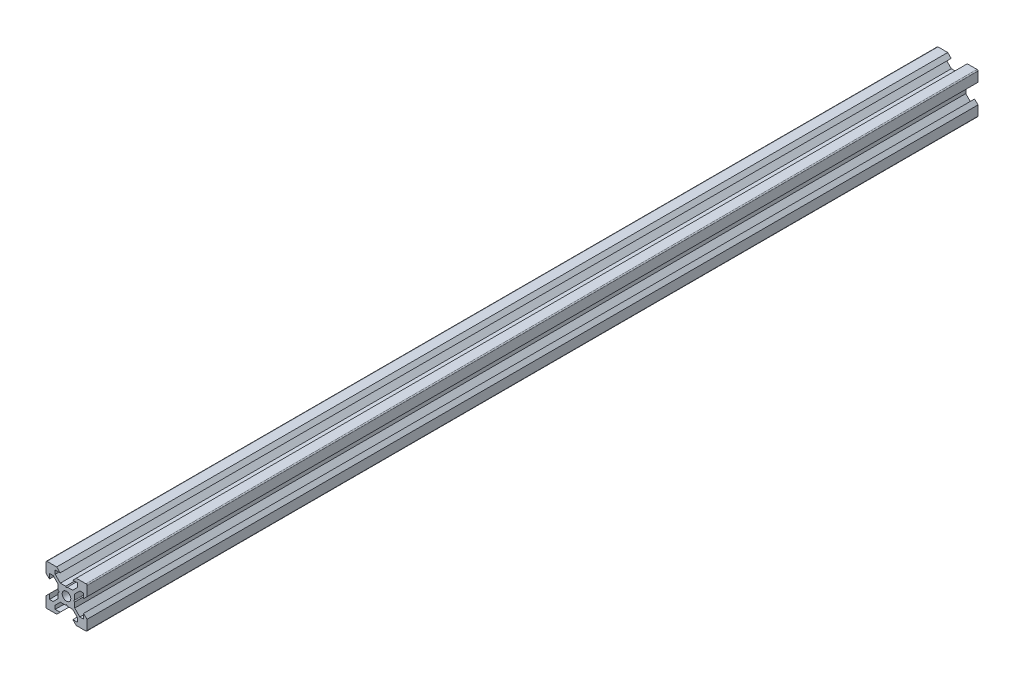
from build123d import *

# Parameters (mm, degrees)
SKETCH1_R           = 2.1
BOSS_EXTRUDE1_DEPTH = 435
FILLET1_R           = 0.5
CUT_EXTRUDE1_DEPTH  = 436.229824346


with BuildPart() as part:
    # Sketch1 → Boss-Extrude1 (new body)
    with BuildSketch(Plane.XY):
        Polygon((-10, 10), (-4.775, 10), (-3.1, 8.325), (-5.5, 8.325), (-5.5, 6.525), (-3, 4.025), (3, 4.025), (5.5, 6.525), (5.5, 8.325), (3.1, 8.325), (4.775, 10), (10, 10), (10, 4.775), (8.325, 3.1), (8.325, 5.5), (6.525, 5.5), (4.025, 3), (4.025, -3), (6.525, -5.5), (8.325, -5.5), (8.325, -3.1), (10, -4.775), (10, -10), (4.775, -10), (3.1, -8.325), (5.5, -8.325), (5.5, -6.525), (3, -4.025), (-3, -4.025), (-5.5, -6.525), (-5.5, -8.325), (-3.1, -8.325), (-4.775, -10), (-10, -10), (-10, -4.775), (-8.325, -3.1), (-8.325, -5.5), (-6.525, -5.5), (-4.025, -3), (-4.025, 3), (-6.525, 5.5), (-8.325, 5.5), (-8.325, 3.1), (-10, 4.775), align=None)
        with Locations(Location((0, 0, 0), (0, 0, 180))):
            Circle(SKETCH1_R, mode=Mode.SUBTRACT)
    extrude(amount=BOSS_EXTRUDE1_DEPTH)

    # Fillet1
    fillet1_edges = [part.edges().sort_by_distance(p)[0] for p in [
        (10, -10, 217.5),
        (-10, -10, 217.5),
        (-10, 10, 217.5),
        (10, 10, 217.5),
    ]]
    fillet(fillet1_edges, radius=FILLET1_R)

    # Sketch2 → Cut-Extrude1 (cut, through all)
    with BuildSketch(Plane.XY.offset(435)):
        with BuildLine():
            ThreePointArc((-4.025, 0.4), (-4.425, 0), (-4.025, -0.4))
            Line((-4.025, -0.4), (-4.025, 0.4))
        make_face()
        with BuildLine():
            Line((-4.025, 0.4), (-4.025, -0.4))
            ThreePointArc((-4.025, -0.4), (-3.742157288, -0.282842712), (-3.625, 0))
            ThreePointArc((-3.625, 0), (-3.742157288, 0.282842712), (-4.025, 0.4))
        make_face()
        with BuildLine():
            ThreePointArc((0.4, 4.025), (0, 4.425), (-0.4, 4.025))
            Line((-0.4, 4.025), (0.4, 4.025))
        make_face()
        with BuildLine():
            Line((0.4, 4.025), (-0.4, 4.025))
            ThreePointArc((-0.4, 4.025), (0, 3.625), (0.4, 4.025))
        make_face()
        with BuildLine():
            ThreePointArc((4.025, 0.4), (3.625, 0), (4.025, -0.4))
            Line((4.025, -0.4), (4.025, 0.4))
        make_face()
        with BuildLine():
            Line((4.025, 0.4), (4.025, -0.4))
            ThreePointArc((4.025, -0.4), (4.307842712, -0.282842712), (4.425, 0))
            ThreePointArc((4.425, 0), (4.307842712, 0.282842712), (4.025, 0.4))
        make_face()
        with BuildLine():
            ThreePointArc((0.4, -4.025), (0, -3.625), (-0.4, -4.025))
            Line((-0.4, -4.025), (0.4, -4.025))
        make_face()
        with BuildLine():
            Line((0.4, -4.025), (-0.4, -4.025))
            ThreePointArc((-0.4, -4.025), (0, -4.425), (0.4, -4.025))
        make_face()
    extrude(amount=-CUT_EXTRUDE1_DEPTH, mode=Mode.SUBTRACT)


solid = part.part
